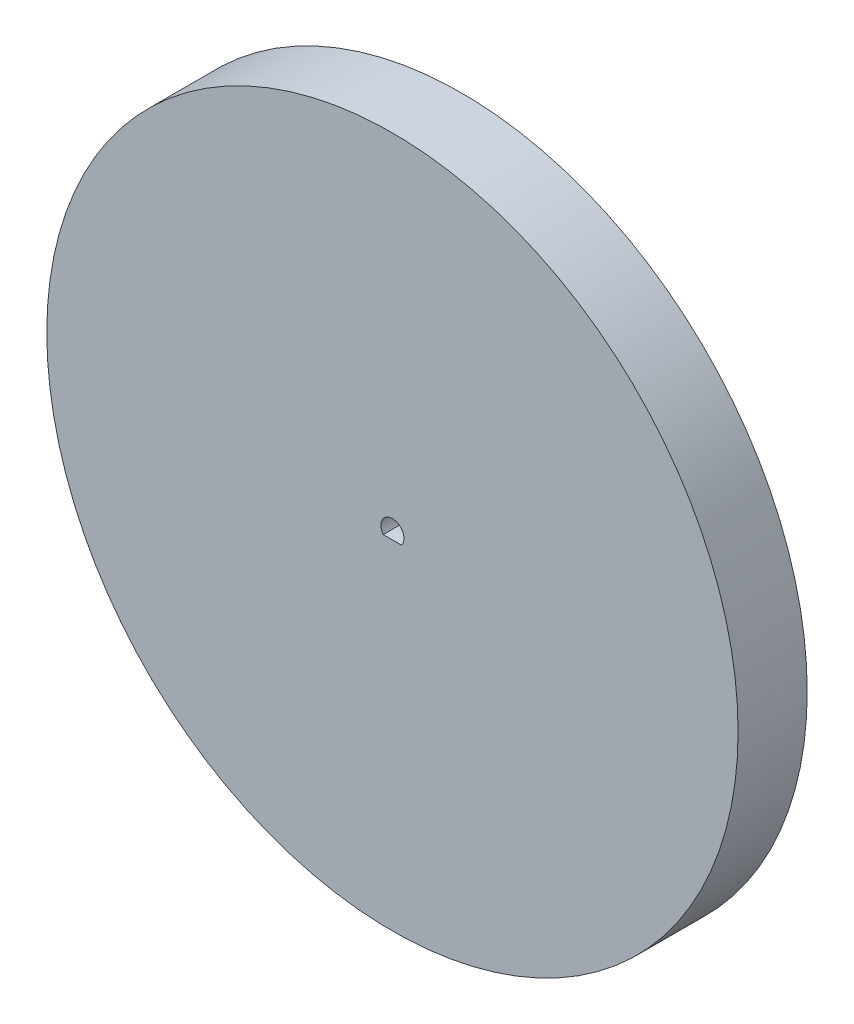
from build123d import *

# Parameters (mm, degrees)
CROQUIS1_R              = 75
CROQUIS1_R_2            = 2.5
SALIENTE_EXTRUIR1_DEPTH = 15


with BuildPart() as part:
    # Croquis1 → Saliente-Extruir1 (new body)
    # profile 1 of 2: a face of its own
    with BuildSketch(Plane.XY):
        Circle(CROQUIS1_R)
        Circle(CROQUIS1_R_2, mode=Mode.SUBTRACT)
    # profile 2 of 2: a face of its own
    with BuildSketch(Plane.XY):
        with BuildLine():
            Line((2, -1.5), (0, -1.5))
            Line((0, -1.5), (-2, -1.5))
            ThreePointArc((-2, -1.5), (0, -2.5), (2, -1.5))
        make_face()
    extrude(amount=SALIENTE_EXTRUIR1_DEPTH)


solid = part.part
